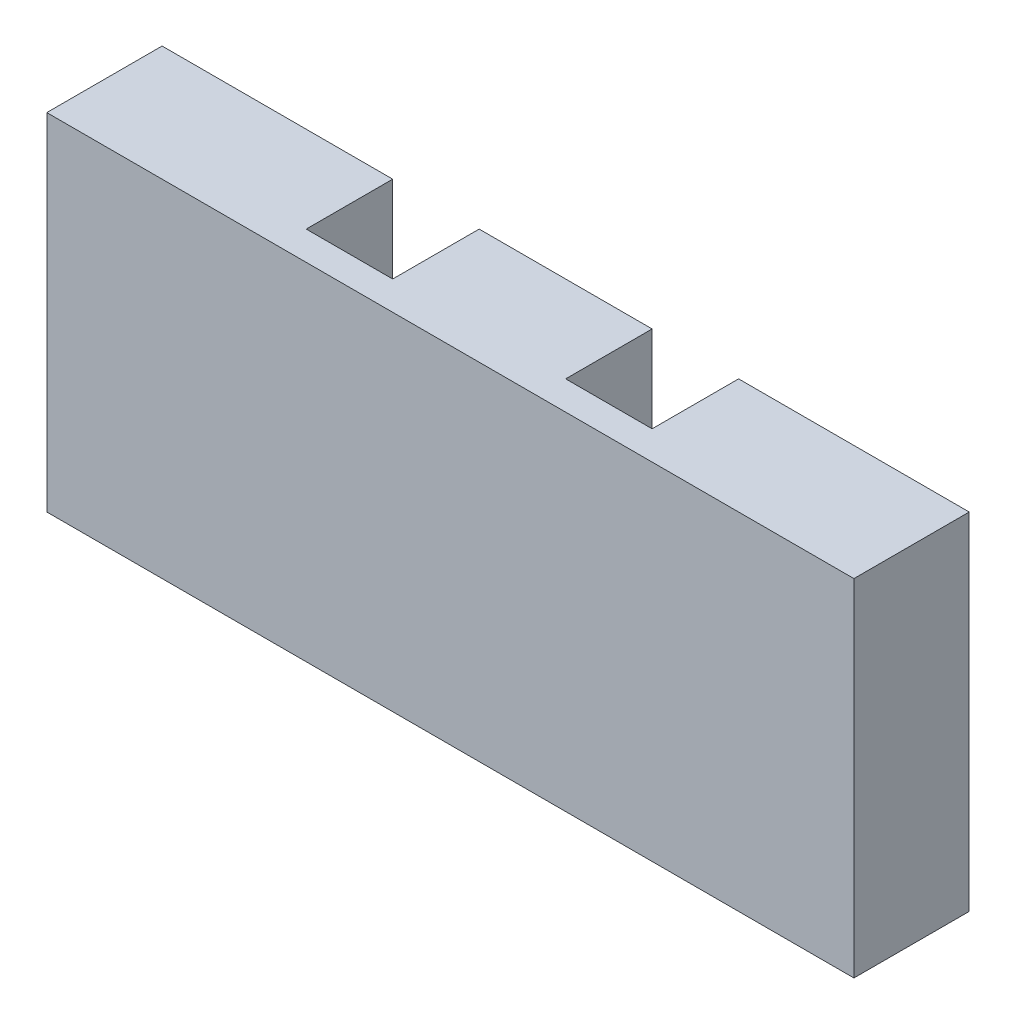
from build123d import *

# Parameters (mm, degrees)
SKETCH_1_W      = 280
SKETCH_1_H      = 120
EXTRUDE_1_DEPTH = 10
SKETCH_2_W      = 60
SKETCH_2_H      = 50
EXTRUDE_2_DEPTH = 30
SKETCH_3_W      = 80
SKETCH_3_H      = 120
EXTRUDE_3_DEPTH = 30


with BuildPart() as part:
    # 스케치1 → 보스-돌출1 (new body)
    with BuildSketch(Plane.XY):
        Rectangle(SKETCH_1_W, SKETCH_1_H)
    extrude(amount=EXTRUDE_1_DEPTH)

    # 스케치2 → 보스-돌출2 (add)
    with BuildSketch(Plane(origin=(0, 0, 0), x_dir=(-1, 0, 0), z_dir=(0, 0, -1))):
        with Locations((0, 35)):
            Rectangle(SKETCH_2_W, SKETCH_2_H)
    extrude(amount=EXTRUDE_2_DEPTH)

    # 스케치3 → 보스-돌출3 (add)
    with BuildSketch(Plane(origin=(0, 0, 0), x_dir=(-1, 0, 0), z_dir=(0, 0, -1))):
        with Locations((-100, 0)):
            Rectangle(SKETCH_3_W, SKETCH_3_H)
        with Locations((100, 0)):
            Rectangle(SKETCH_3_W, SKETCH_3_H)
    extrude(amount=EXTRUDE_3_DEPTH)


solid = part.part
